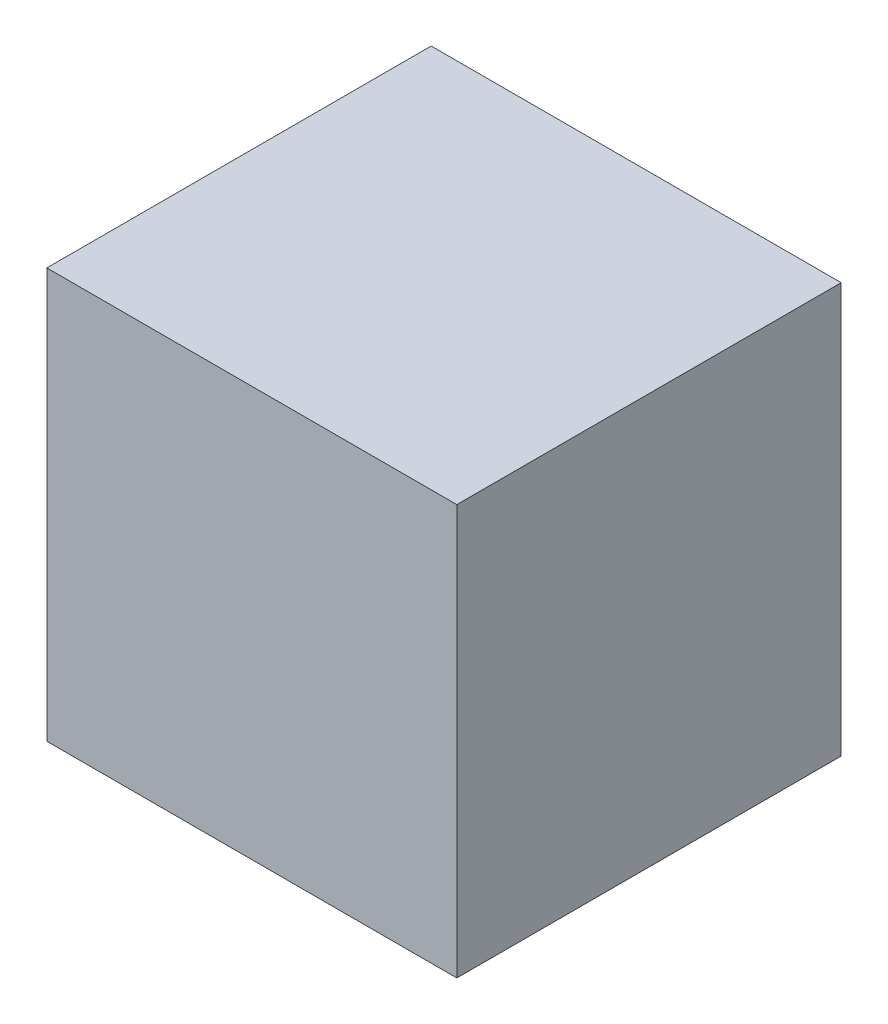
from build123d import *

# Parameters (mm, degrees)
SKETCH1_W           = 16
SKETCH1_H           = 15
BOSS_EXTRUDE1_DEPTH = 16


with BuildPart() as part:
    # Sketch1 → Boss-Extrude1 (new body)
    with BuildSketch(Plane(origin=(0, 0, 0), x_dir=(1, 0, 0), z_dir=(0, 1, 0))):
        with Locations((8, -7.5)):
            Rectangle(SKETCH1_W, SKETCH1_H)
    extrude(amount=BOSS_EXTRUDE1_DEPTH)


solid = part.part
